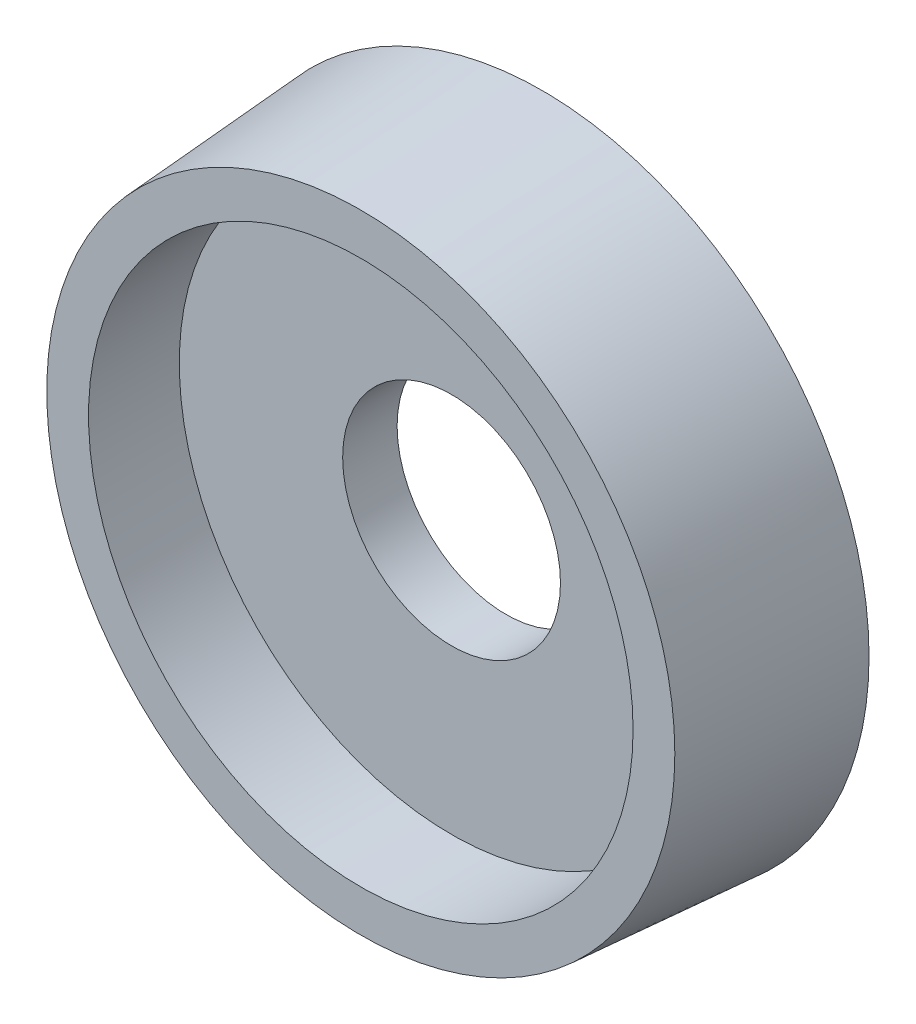
from build123d import *

# Parameters (mm, degrees)
SKETCH_1_R               = 9
EXTRUDE_1_DEPTH          = 5
EXTRUDE_1_TAPER          = 4
SKETCH_3_R               = 5
CUT_EXTRUDE_1_DEPTH      = 1
SKETCH_4_R               = 7.5
CUT_EXTRUDE_2_DEPTH      = 2.5
CUT_EXTRUDE_3_DEPTH      = 13.971121771
CUT_EXTRUDE_3_DEPTH_BACK = 13.971121771
SKETCH_5_R               = 3


with BuildPart() as part:
    # Эскиз1 → Бобышка-Вытянуть1 (new body)
    with BuildSketch(Plane.XY):
        Circle(SKETCH_1_R)
    extrude(amount=EXTRUDE_1_DEPTH, taper=EXTRUDE_1_TAPER)

    # Эскиз3 → Вырез-Вытянуть1 (cut)
    with BuildSketch(Plane(origin=(0, 0, 0), x_dir=(-1, 0, 0), z_dir=(0, 0, -1))):
        Circle(SKETCH_3_R)
    extrude(amount=-CUT_EXTRUDE_1_DEPTH, mode=Mode.SUBTRACT)

    # Эскиз4 → Вырез-Вытянуть2 (cut)
    with BuildSketch(Plane.XY.offset(5)):
        Circle(SKETCH_4_R)
    extrude(amount=-CUT_EXTRUDE_2_DEPTH, mode=Mode.SUBTRACT)

    # Эскиз5 → Вырез-Вытянуть3 (cut, two sides: drawn at the far end of the back side and taken through both)
    with BuildSketch(Plane.XY.offset(2.5).offset(-CUT_EXTRUDE_3_DEPTH_BACK)):
        Circle(SKETCH_5_R)
    extrude(amount=CUT_EXTRUDE_3_DEPTH + CUT_EXTRUDE_3_DEPTH_BACK, mode=Mode.SUBTRACT)


solid = part.part
